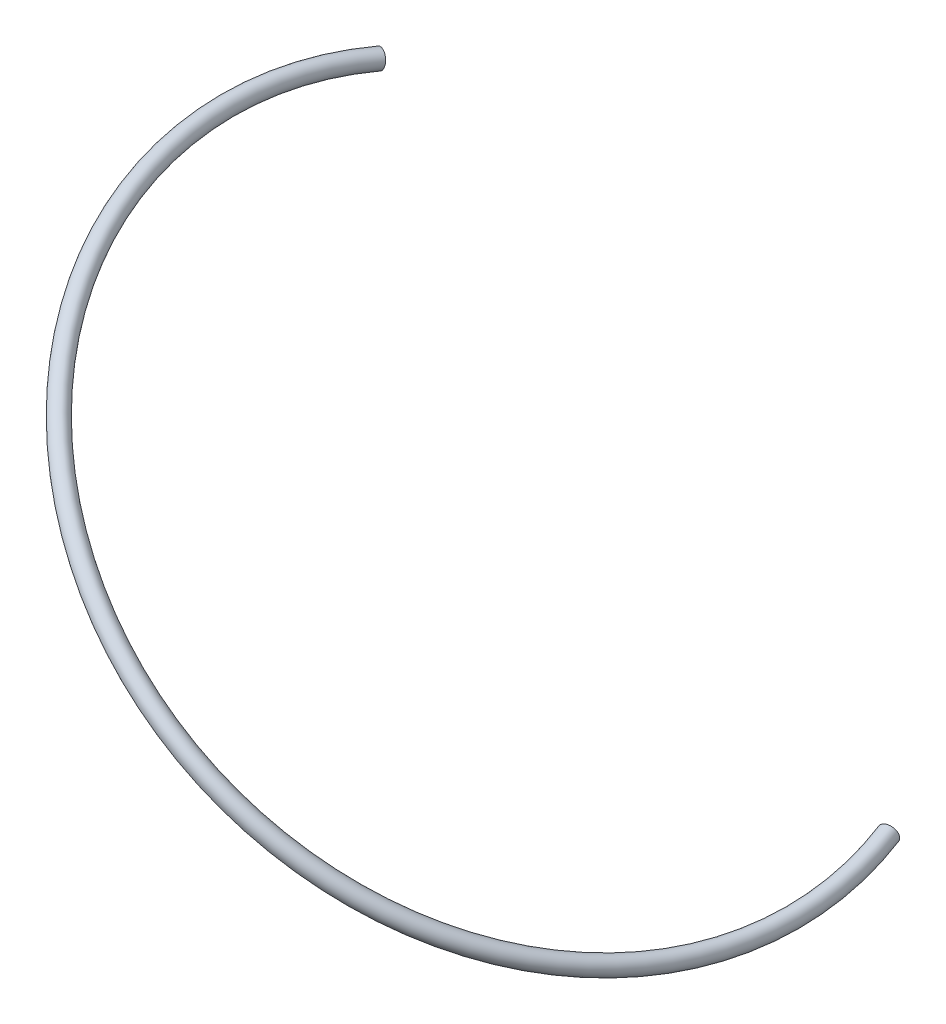
from build123d import *

# Parameters (mm, degrees)
SWEEP1_PROFILE_R = 2


with BuildPart() as part:
    # Sweep1: sweep along a path in Sketch2
    with BuildLine(Plane(origin=(55.676466286, 74.714629098, 0), x_dir=(0.8018481564112218, -0.5975278521206562, 0), z_dir=(0.5975278521206562, 0.8018481564112218, 0))) as sweep1_path:
        ThreePointArc((81.777993988, -22.25), (152.899294709, -131.113065875), (230.80870391, -27))
    # Sweep1 profile (on start of the path) → Sweep1 (sweep)
    with BuildSketch(Plane(origin=(121.25, 25.85, 22.25), x_dir=(0.9519535578094455, 0, 0.3062424264760502), z_dir=(-0.29856656964447276, 0.2224883098480332, 0.9280931825370219))):
        Circle(SWEEP1_PROFILE_R)
    sweep(path=sweep1_path.line)


solid = part.part
